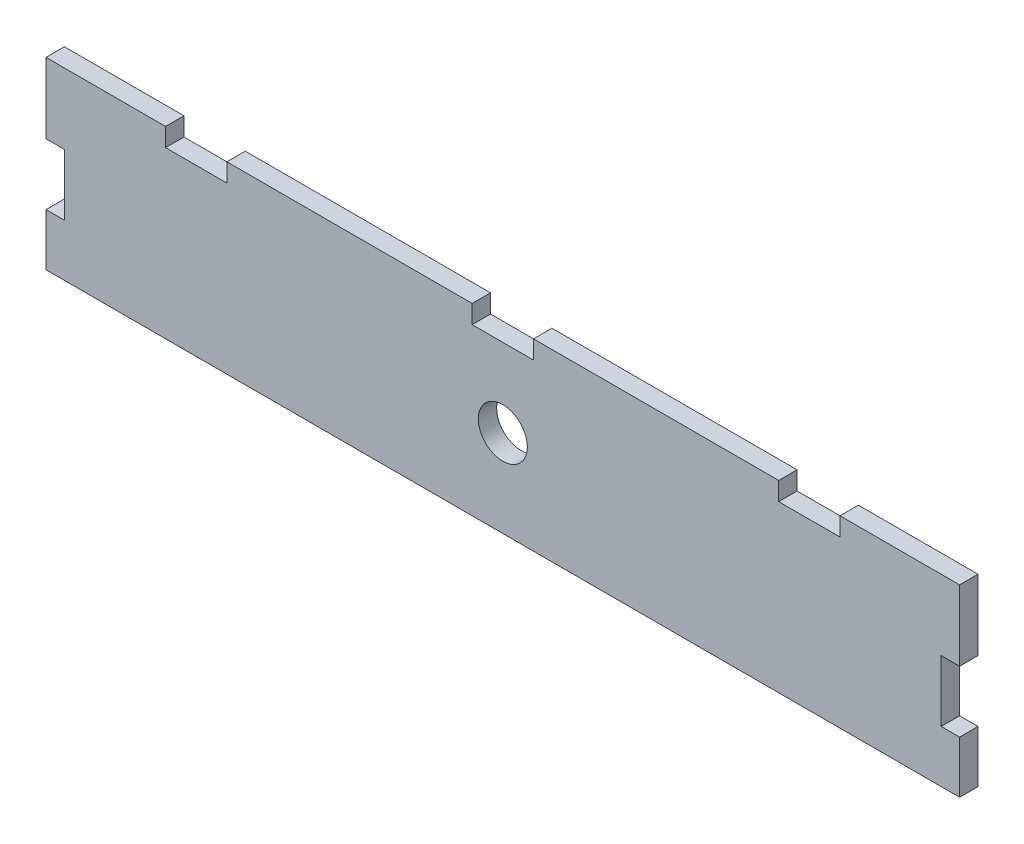
from build123d import *

# Parameters (mm, degrees)
BOSS_EXTRUDE1_DEPTH = 3
SKETCH2_R           = 4
CUT_EXTRUDE1_DEPTH  = 80.298486745


with BuildPart() as part:
    # Sketch1 → Boss-Extrude1 (new body)
    with BuildSketch(Plane.XY):
        Polygon((-74.5, 3), (-74.5, -8.5), (-71.5, -8.5), (-71.5, -18.5), (-74.5, -18.5), (-74.5, -27), (74.5, -27), (74.5, -18.5), (71.5, -18.5), (71.5, -8.5), (74.5, -8.5), (74.5, 3), (55, 3), (55, 0), (45, 0), (45, 3), (5, 3), (5, 0), (-5, 0), (-5, 3), (-45, 3), (-45, 0), (-55, 0), (-55, 3), align=None)
    extrude(amount=BOSS_EXTRUDE1_DEPTH)

    # Sketch2 → Cut-Extrude1 (cut, through all)
    with BuildSketch(Plane.XY):
        with Locations((0, -12.79)):
            Circle(SKETCH2_R)
    extrude(amount=CUT_EXTRUDE1_DEPTH, mode=Mode.SUBTRACT)


solid = part.part
